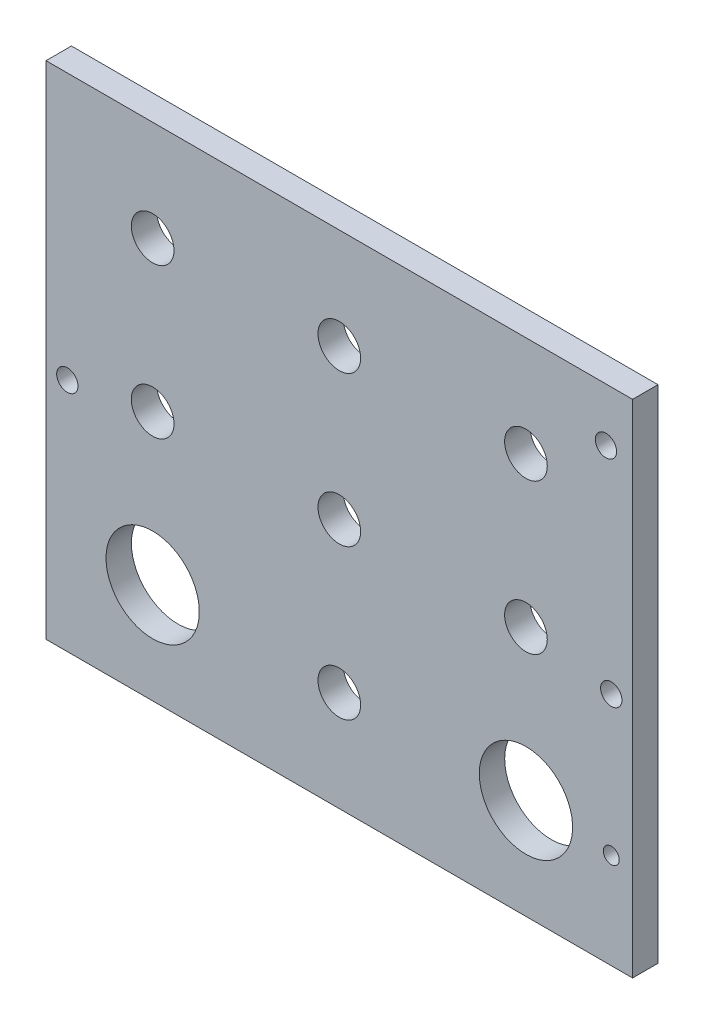
from build123d import *

# Parameters (mm, degrees)
CROQUIS1_W               = 90
CROQUIS1_H               = 76.2
CROQUIS1_R               = 4
SALIENTE_EXTRUIR1_DEPTH  = 0.47625
CROQUIS1_2_W             = 90
CROQUIS1_2_H             = 76.2
CROQUIS1_2_R             = 4
SALIENTE_EXTRUIR2_DEPTH  = 4.7625
CROQUIS3_W               = 90
CROQUIS3_H               = 4.7625
SALIENTE_EXTRUIR3_DEPTH  = 4.445
CROQUIS5_W               = 90
CROQUIS5_H               = 4.7625
SALIENTE_EXTRUIR4_DEPTH  = 4.445
CROQUIS6_W               = 4.7625
CROQUIS6_H               = 85.09
SALIENTE_EXTRUIR5_DEPTH  = 5
CROQUIS7_W               = 4.7625
CROQUIS7_H               = 85.09
SALIENTE_EXTRUIR6_DEPTH  = 5
CROQUIS8_W               = 100
CROQUIS8_H               = 4.7625
SALIENTE_EXTRUIR7_DEPTH  = 4.445
CROQUIS9_W               = 100
CROQUIS9_H               = 4.7625
SALIENTE_EXTRUIR8_DEPTH  = 4.445
CROQUIS10_W              = 4.7625
CROQUIS10_H              = 93.98
SALIENTE_EXTRUIR9_DEPTH  = 5
CROQUIS12_W              = 4.7625
CROQUIS12_H              = 93.98
SALIENTE_EXTRUIR10_DEPTH = 5
SKETCH1_R                = 8.75
CUT_EXTRUDE1_DEPTH       = 10
SKETCH2_R                = 2
CUT_EXTRUDE2_DEPTH       = 10
SKETCH3_R                = 1.5
CUT_EXTRUDE3_DEPTH       = 10
SKETCH4_R                = 2
CUT_EXTRUDE4_DEPTH       = 10


with BuildPart() as part:
    # Croquis1 → Saliente-Extruir1 (new body)
    with BuildSketch(Plane.XY):
        with Locations((45, 38.1)):
            Rectangle(CROQUIS1_W, CROQUIS1_H)
        with Locations((45, 38.1)):
            Circle(CROQUIS1_R, mode=Mode.SUBTRACT)
        with Locations((10, 9.95)):
            Circle(CROQUIS1_R, mode=Mode.SUBTRACT)
        with Locations((10, 66.25)):
            Circle(CROQUIS1_R, mode=Mode.SUBTRACT)
        with Locations((80, 66.25)):
            Circle(CROQUIS1_R, mode=Mode.SUBTRACT)
        with Locations((80, 9.95)):
            Circle(CROQUIS1_R, mode=Mode.SUBTRACT)
        with Locations((45, 66.25)):
            Circle(CROQUIS1_R, mode=Mode.SUBTRACT)
        with Locations((10, 38.1)):
            Circle(CROQUIS1_R, mode=Mode.SUBTRACT)
        with Locations((80, 38.1)):
            Circle(CROQUIS1_R, mode=Mode.SUBTRACT)
        with Locations((45, 9.95)):
            Circle(CROQUIS1_R, mode=Mode.SUBTRACT)
    extrude(amount=SALIENTE_EXTRUIR1_DEPTH)

    # Croquis1<2> → Saliente-Extruir2 (add)
    with BuildSketch(Plane.XY):
        with Locations((45, 38.1)):
            Rectangle(CROQUIS1_2_W, CROQUIS1_2_H)
        with Locations((45, 38.1)):
            Circle(CROQUIS1_2_R, mode=Mode.SUBTRACT)
        with Locations((10, 9.95)):
            Circle(CROQUIS1_2_R, mode=Mode.SUBTRACT)
        with Locations((10, 66.25)):
            Circle(CROQUIS1_2_R, mode=Mode.SUBTRACT)
        with Locations((80, 66.25)):
            Circle(CROQUIS1_2_R, mode=Mode.SUBTRACT)
        with Locations((80, 9.95)):
            Circle(CROQUIS1_2_R, mode=Mode.SUBTRACT)
        with Locations((45, 66.25)):
            Circle(CROQUIS1_2_R, mode=Mode.SUBTRACT)
        with Locations((10, 38.1)):
            Circle(CROQUIS1_2_R, mode=Mode.SUBTRACT)
        with Locations((80, 38.1)):
            Circle(CROQUIS1_2_R, mode=Mode.SUBTRACT)
        with Locations((45, 9.95)):
            Circle(CROQUIS1_2_R, mode=Mode.SUBTRACT)
    extrude(amount=SALIENTE_EXTRUIR2_DEPTH)

    # Croquis3 → Saliente-Extruir3 (add)
    with BuildSketch(Plane.XZ):
        with Locations((45, 2.38125)):
            Rectangle(CROQUIS3_W, CROQUIS3_H)
    extrude(amount=SALIENTE_EXTRUIR3_DEPTH)

    # Croquis5 → Saliente-Extruir4 (add)
    with BuildSketch(Plane(origin=(0, 76.2, 0), x_dir=(1, 0, 0), z_dir=(0, 1, 0))):
        with Locations((45, -2.38125)):
            Rectangle(CROQUIS5_W, CROQUIS5_H)
    extrude(amount=SALIENTE_EXTRUIR4_DEPTH)

    # Croquis6 → Saliente-Extruir5 (add)
    with BuildSketch(Plane.ZY):
        with Locations((2.38125, 38.1)):
            Rectangle(CROQUIS6_W, CROQUIS6_H)
    extrude(amount=SALIENTE_EXTRUIR5_DEPTH)

    # Croquis7 → Saliente-Extruir6 (add)
    with BuildSketch(Plane(origin=(90, 0, 0), x_dir=(0, 0, -1), z_dir=(1, 0, 0))):
        with Locations((-2.38125, 38.1)):
            Rectangle(CROQUIS7_W, CROQUIS7_H)
    extrude(amount=SALIENTE_EXTRUIR6_DEPTH)

    # Croquis8 → Saliente-Extruir7 (add)
    with BuildSketch(Plane.XZ.offset(4.445)):
        with Locations((45, 2.38125)):
            Rectangle(CROQUIS8_W, CROQUIS8_H)
    extrude(amount=SALIENTE_EXTRUIR7_DEPTH)

    # Croquis9 → Saliente-Extruir8 (add)
    with BuildSketch(Plane(origin=(0, 80.645, 0), x_dir=(1, 0, 0), z_dir=(0, 1, 0))):
        with Locations((45, -2.38125)):
            Rectangle(CROQUIS9_W, CROQUIS9_H)
    extrude(amount=SALIENTE_EXTRUIR8_DEPTH)

    # Croquis10 → Saliente-Extruir9 (add)
    with BuildSketch(Plane(origin=(95, 0, 0), x_dir=(0, 0, -1), z_dir=(1, 0, 0))):
        with Locations((-2.38125, 38.1)):
            Rectangle(CROQUIS10_W, CROQUIS10_H)
    extrude(amount=SALIENTE_EXTRUIR9_DEPTH)

    # Croquis12 → Saliente-Extruir10 (add)
    with BuildSketch(Plane.ZY.offset(5)):
        with Locations((2.38125, 38.1)):
            Rectangle(CROQUIS12_W, CROQUIS12_H)
    extrude(amount=SALIENTE_EXTRUIR10_DEPTH)

    # Sketch1 → Cut-Extrude1 (cut)
    with BuildSketch(Plane(origin=(0, 0, 0), x_dir=(-1, 0, 0), z_dir=(0, 0, -1))):
        with Locations((-80, 9.95)):
            Circle(SKETCH1_R)
        with Locations((-10, 9.95)):
            Circle(SKETCH1_R)
    extrude(amount=-CUT_EXTRUDE1_DEPTH, mode=Mode.SUBTRACT)

    # Sketch2 → Cut-Extrude2 (cut)
    with BuildSketch(Plane(origin=(0, 0, 0), x_dir=(-1, 0, 0), z_dir=(0, 0, -1))):
        with Locations((-95, 75.09)):
            Circle(SKETCH2_R)
    extrude(amount=-CUT_EXTRUDE2_DEPTH, mode=Mode.SUBTRACT)

    # Sketch3 → Cut-Extrude3 (cut)
    with BuildSketch(Plane.XY.offset(4.7625)):
        with Locations((96, 9.026516715)):
            Circle(SKETCH3_R)
    extrude(amount=-CUT_EXTRUDE3_DEPTH, mode=Mode.SUBTRACT)

    # Sketch4 → Cut-Extrude4 (cut)
    with BuildSketch(Plane(origin=(0, 0, 0), x_dir=(-1, 0, 0), z_dir=(0, 0, -1))):
        with Locations((6, 35.220430455)):
            Circle(SKETCH4_R)
        with Locations((-96, 35.220430455)):
            Circle(SKETCH4_R)
    extrude(amount=-CUT_EXTRUDE4_DEPTH, mode=Mode.SUBTRACT)


solid = part.part
